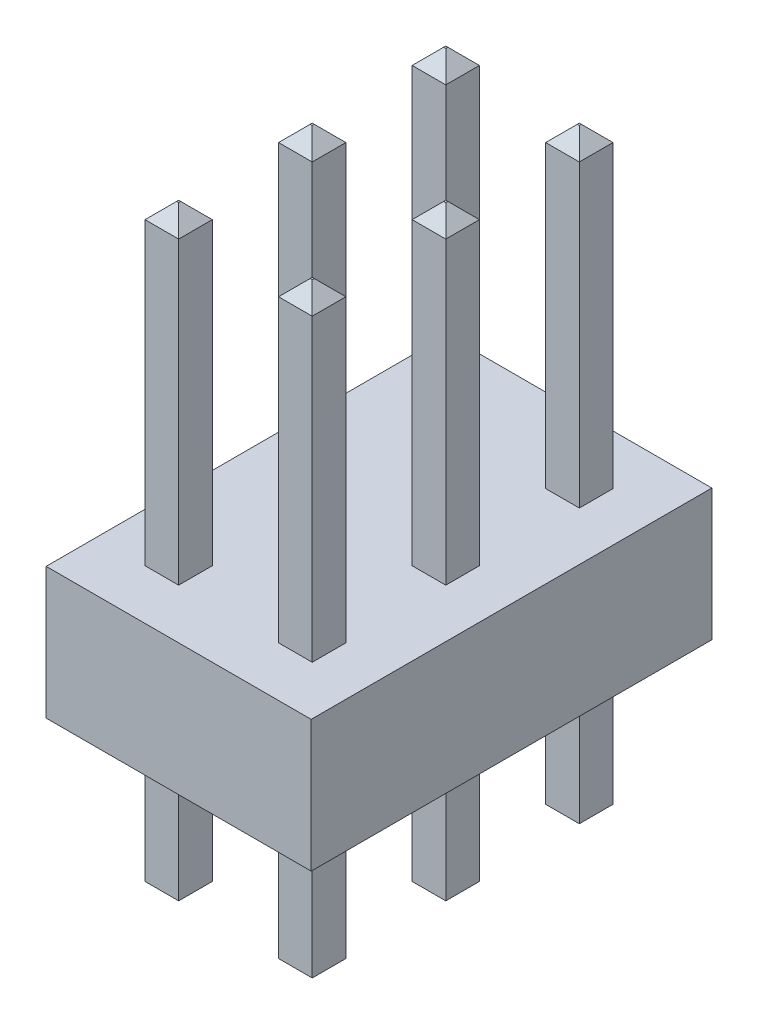
from build123d import *

# Parameters (mm, degrees)
SKIZZE1_W                       = 5.04
SKIZZE1_H                       = 2.5
AUFSATZ_LINEAR_AUSTRAGEN1_DEPTH = 7.62
SKIZZE2_W                       = 0.64
SKIZZE2_H                       = 0.64
AUFSATZ_LINEAR_AUSTRAGEN2_DEPTH = 6
FASE1_SIZE                      = 0.3
SKIZZE3_W                       = 0.64
SKIZZE3_H                       = 0.64
AUFSATZ_LINEAR_AUSTRAGEN3_DEPTH = 3
FASE2_SIZE                      = 0.3


with BuildPart() as part:
    # Skizze1 → Aufsatz-Linear austragen1 (new body)
    with BuildSketch(Plane.XY):
        with Locations((2.52, 1.25)):
            Rectangle(SKIZZE1_W, SKIZZE1_H)
    extrude(amount=AUFSATZ_LINEAR_AUSTRAGEN1_DEPTH)

    # Skizze2 → Aufsatz-Linear austragen2 (add)
    with BuildSketch(Plane(origin=(0, 2.5, 0), x_dir=(1, 0, 0), z_dir=(0, 1, 0))):
        with Locations((3.79, -1.27)):
            Rectangle(SKIZZE2_W, SKIZZE2_H)
        with Locations((1.25, -1.27)):
            Rectangle(SKIZZE2_W, SKIZZE2_H)
        with Locations((1.25, -3.81)):
            Rectangle(SKIZZE2_W, SKIZZE2_H)
        with Locations((3.79, -3.81)):
            Rectangle(SKIZZE2_W, SKIZZE2_H)
        with Locations((1.25, -6.35)):
            Rectangle(SKIZZE2_W, SKIZZE2_H)
        with Locations((3.79, -6.35)):
            Rectangle(SKIZZE2_W, SKIZZE2_H)
    extrude(amount=AUFSATZ_LINEAR_AUSTRAGEN2_DEPTH)

    # Fase1
    fase1_edges = [part.edges().sort_by_distance(p)[0] for p in [
        (1.57, 8.5, 1.27),
        (1.25, 8.5, 0.95),
        (0.93, 8.5, 1.27),
        (1.25, 8.5, 1.59),
        (4.11, 8.5, 1.27),
        (3.79, 8.5, 0.95),
        (3.47, 8.5, 1.27),
        (3.79, 8.5, 1.59),
        (1.57, 8.5, 3.81),
        (1.25, 8.5, 3.49),
        (0.93, 8.5, 3.81),
        (1.25, 8.5, 4.13),
        (4.11, 8.5, 3.81),
        (3.79, 8.5, 3.49),
        (3.47, 8.5, 3.81),
        (3.79, 8.5, 4.13),
        (1.57, 8.5, 6.35),
        (1.25, 8.5, 6.03),
        (0.93, 8.5, 6.35),
        (1.25, 8.5, 6.67),
        (4.11, 8.5, 6.35),
        (3.79, 8.5, 6.03),
        (3.47, 8.5, 6.35),
        (3.79, 8.5, 6.67),
    ]]
    chamfer(fase1_edges, length=FASE1_SIZE)

    # Skizze3 → Aufsatz-Linear austragen3 (add)
    with BuildSketch(Plane.XZ):
        with Locations((1.25, 1.27)):
            Rectangle(SKIZZE3_W, SKIZZE3_H)
        with Locations((3.79, 1.27)):
            Rectangle(SKIZZE3_W, SKIZZE3_H)
        with Locations((1.25, 3.81)):
            Rectangle(SKIZZE3_W, SKIZZE3_H)
        with Locations((3.79, 3.81)):
            Rectangle(SKIZZE3_W, SKIZZE3_H)
        with Locations((1.25, 6.35)):
            Rectangle(SKIZZE3_W, SKIZZE3_H)
        with Locations((3.79, 6.35)):
            Rectangle(SKIZZE3_W, SKIZZE3_H)
    extrude(amount=AUFSATZ_LINEAR_AUSTRAGEN3_DEPTH)

    # Fase2
    fase2_edges = [part.edges().sort_by_distance(p)[0] for p in [
        (1.57, -3, 1.27),
        (1.25, -3, 1.59),
        (0.93, -3, 1.27),
        (1.25, -3, 0.95),
        (4.11, -3, 1.27),
        (3.79, -3, 1.59),
        (3.47, -3, 1.27),
        (3.79, -3, 0.95),
        (1.57, -3, 3.81),
        (1.25, -3, 4.13),
        (0.93, -3, 3.81),
        (1.25, -3, 3.49),
        (4.11, -3, 3.81),
        (3.79, -3, 4.13),
        (3.47, -3, 3.81),
        (3.79, -3, 3.49),
        (1.57, -3, 6.35),
        (1.25, -3, 6.67),
        (0.93, -3, 6.35),
        (1.25, -3, 6.03),
        (4.11, -3, 6.35),
        (3.79, -3, 6.67),
        (3.47, -3, 6.35),
        (3.79, -3, 6.03),
    ]]
    chamfer(fase2_edges, length=FASE2_SIZE)


solid = part.part
